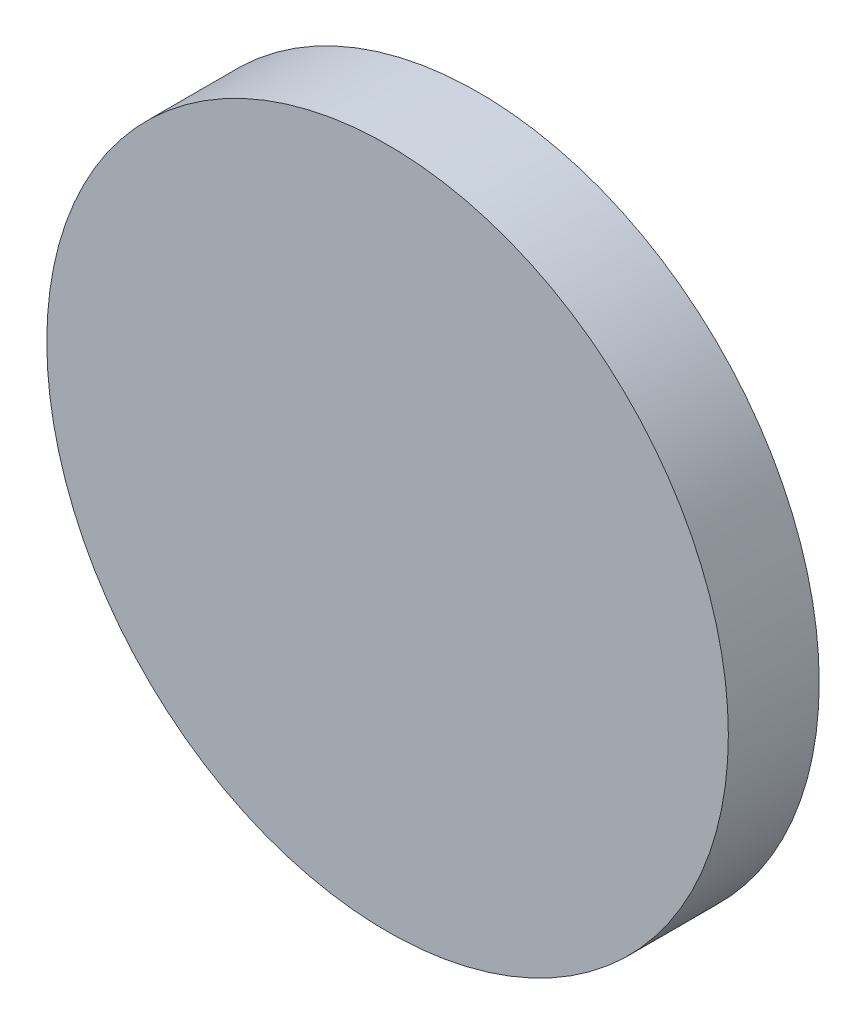
from build123d import *

# Parameters (mm, degrees)
SKETCH2_R           = 75
BOSS_EXTRUDE1_DEPTH = 20


with BuildPart() as part:
    # Sketch2 → Boss-Extrude1 (new body)
    with BuildSketch(Plane.XY):
        Circle(SKETCH2_R)
    extrude(amount=BOSS_EXTRUDE1_DEPTH)


solid = part.part
